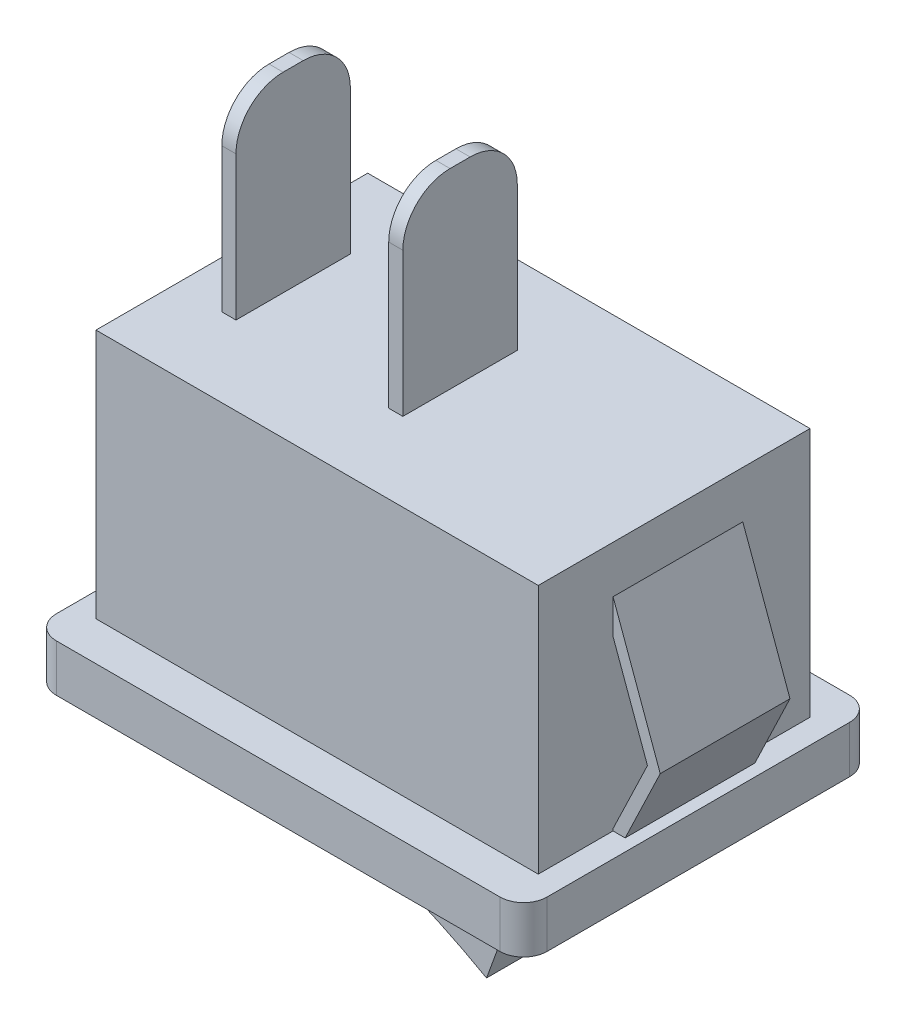
from build123d import *

# Parameters (mm, degrees)
SKETCH1_W           = 18.75
SKETCH1_H           = 11.52
BOSS_EXTRUDE1_DEPTH = 10.6
SKETCH2_W           = 20.8
SKETCH2_H           = 14.82
BOSS_EXTRUDE2_DEPTH = 2
BOSS_EXTRUDE3_START = -2.5
BOSS_EXTRUDE3_DEPTH = 9.6
SKETCH5_W           = 0.6
SKETCH5_H           = 4.85
BOSS_EXTRUDE4_DEPTH = 8.1
BOSS_EXTRUDE5_START = -2.85
BOSS_EXTRUDE5_DEPTH = 5.5
FILLET1_R           = 2
FILLET2_R           = 1


with BuildPart() as part:
    # Sketch1 → Boss-Extrude1 (new body)
    with BuildSketch(Plane(origin=(0, 0, 0), x_dir=(1, 0, 0), z_dir=(0, 1, 0))):
        Rectangle(SKETCH1_W, SKETCH1_H)
    extrude(amount=BOSS_EXTRUDE1_DEPTH)

    # Sketch2 → Boss-Extrude2 (add)
    with BuildSketch(Plane(origin=(0, 0, 0), x_dir=(1, 0, 0), z_dir=(0, 1, 0))):
        Rectangle(SKETCH2_W, SKETCH2_H)
    extrude(amount=-BOSS_EXTRUDE2_DEPTH)

    # Sketch4 → Boss-Extrude3 (add)
    with BuildSketch(Plane.XY.offset(7.41).offset(BOSS_EXTRUDE3_START)):
        with BuildLine():
            Line((7.7, -2), (-7.7, -2))
            add(Edge.make_bspline(
                [(-7.7, -2), (-0.364289246, -2.017203107), (6.331919427, -5.758770483)],
                knots=[0, 0, 0, 1, 1, 1], degree=2))
            Line((6.331919427, -5.758770483), (7.7, -2))
        make_face()
    extrude(amount=-BOSS_EXTRUDE3_DEPTH)

    # Sketch5 → Boss-Extrude4 (add)
    with BuildSketch(Plane(origin=(0, 10.6, 0), x_dir=(1, 0, 0), z_dir=(0, 1, 0))):
        with Locations((-7.075, 0)):
            Rectangle(SKETCH5_W, SKETCH5_H)
        Rectangle(SKETCH5_W, SKETCH5_H)
    extrude(amount=BOSS_EXTRUDE4_DEPTH)

    # Sketch6 → Boss-Extrude5 (add)
    with BuildSketch(Plane(origin=(0, 0, -5.76), x_dir=(-1, 0, 0), z_dir=(0, 0, -1)).offset(BOSS_EXTRUDE5_START)):
        Polygon((11.375, 3.105045161), (9.375, 8.6), (9.375, 7.1380978), (10.833272639, 3.131526652), (9.436573077, 0.216020625), (9.375, 0.087491424), (9.375, 0), (9.8875, 0), align=None)
    boss_extrude5 = extrude(amount=-BOSS_EXTRUDE5_DEPTH)

    # Mirror1: Boss-Extrude5 across plane
    add(boss_extrude5.mirror(Plane(origin=(0, 0, 0), x_dir=(0, 0, 1), z_dir=(1, 0, 0))))

    # Fillet1
    fillet1_edges = [part.edges().sort_by_distance(p)[0] for p in [
        (-7.075, 18.7, -2.425),
        (-7.075, 18.7, 2.425),
        (0, 18.7, -2.425),
        (0, 18.7, 2.425),
    ]]
    fillet(fillet1_edges, radius=FILLET1_R)

    # Fillet2
    fillet2_edges = [part.edges().sort_by_distance(p)[0] for p in [
        (10.4, -1, -7.41),
        (10.4, -1, 7.41),
        (-10.4, -1, 7.41),
        (-10.4, -1, -7.41),
    ]]
    fillet(fillet2_edges, radius=FILLET2_R)


solid = part.part
